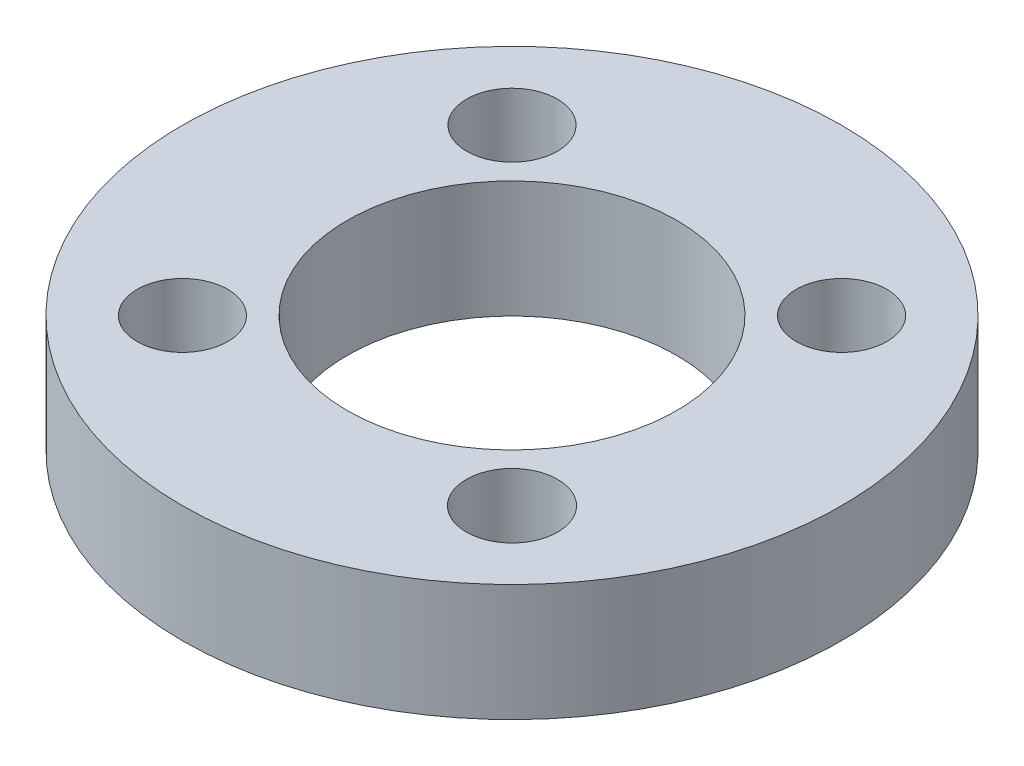
from build123d import *

# Parameters (mm, degrees)
SKETCH1_R           = 10
SKETCH1_R_2         = 5
SKETCH1_R_3         = 1.375
SKETCH1_R_4         = 1.386376747
BOSS_EXTRUDE1_DEPTH = 3.55


with BuildPart() as part:
    # Sketch1 → Boss-Extrude1 (new body)
    with BuildSketch(Plane(origin=(0, 0, 0), x_dir=(1, 0, 0), z_dir=(0, 1, 0))):
        with Locations(Location((0, 0, 0), (0, 0, 270))):
            Circle(SKETCH1_R)
        with Locations(Location((0, 0, 0), (0, 0, 270))):
            Circle(SKETCH1_R_2, mode=Mode.SUBTRACT)
        with Locations(Location((-5, -5, 0), (0, 0, 270))):
            Circle(SKETCH1_R_3, mode=Mode.SUBTRACT)
        with Locations(Location((5, -5, 0), (0, 0, 270))):
            Circle(SKETCH1_R_4, mode=Mode.SUBTRACT)
        with Locations(Location((5, 5, 0), (0, 0, 270))):
            Circle(SKETCH1_R_3, mode=Mode.SUBTRACT)
        with Locations(Location((-5, 5, 0), (0, 0, 270))):
            Circle(SKETCH1_R_3, mode=Mode.SUBTRACT)
    extrude(amount=BOSS_EXTRUDE1_DEPTH)


solid = part.part
